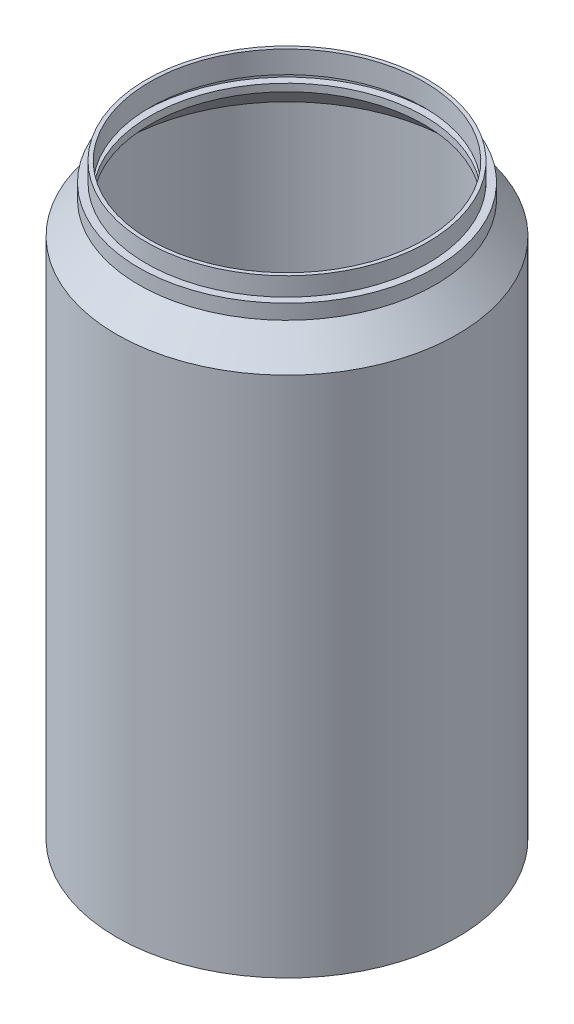
from build123d import *


with BuildPart() as part:
    # Sketch1 → Revolve-Thin1 (revolve)
    with BuildSketch(Plane(origin=(-3.343067137, 93.173104477, 24.269036423), x_dir=(1, 0, 0), z_dir=(0, 0, 1)), mode=Mode.PRIVATE) as revolve_thin1_sk:
        Polygon((-33.656932863, 68.327933214), (-33.656932863, 62.327933214), (-35.656932863, 62.327933214), (-35.656932863, 60.327933214), (-33.656932863, 60.327933214), (-33.656932863, 58.327933214), (-41.656932863, 50.327933214), (-41.656932863, -89.672066786), (-33.656932863, -95.273727092), (-28.656932863, -95.273727092), (-25.656932863, -93.173104477), (3.343067137, -93.173104477), (3.343067137, -94.173104477), (-25.341634074, -94.173104477), (-28.341634074, -96.273727092), (-33.972231651, -96.273727092), (-42.656932863, -90.192633837), (-42.656932863, 50.742146776), (-34.656932863, 58.742146776), (-34.656932863, 59.327933214), (-36.656932863, 59.327933214), (-36.656932863, 63.327933214), (-34.656932863, 63.327933214), (-34.656932863, 68.327933214), align=None)
    revolve(revolve_thin1_sk.sketch.rotate(Axis((0, 0, 24.269036423), (0, 1, 0)), 270), axis=Axis((0, 0, 24.269036423), (0, 1, 0)))


solid = part.part
